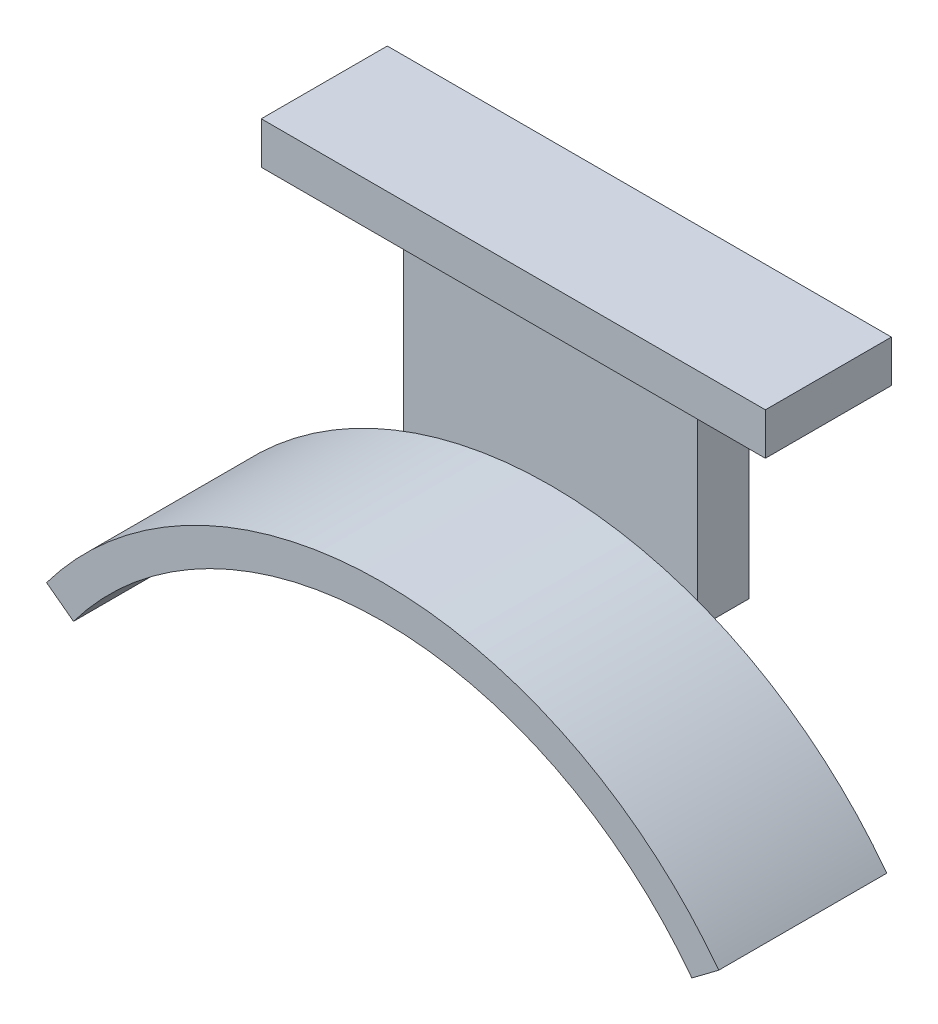
from build123d import *

# Parameters (mm, degrees)
SKETCH1_W           = 76.2
SKETCH1_H           = 19.05
BOSS_EXTRUDE1_DEPTH = 6.35
SKETCH2_W           = 44.45
SKETCH2_H           = 7.782009592
BOSS_EXTRUDE2_DEPTH = 33.02
EXTRUDE_THIN1_DEPTH = 25.4
CHAMFER1_SIZE       = 3.81


with BuildPart() as part:
    # Sketch1 → Boss-Extrude1 (new body)
    with BuildSketch(Plane(origin=(0, 0, 0), x_dir=(1, 0, 0), z_dir=(0, 1, 0))):
        Rectangle(SKETCH1_W, SKETCH1_H)
    extrude(amount=BOSS_EXTRUDE1_DEPTH)

    # Sketch2 → Boss-Extrude2 (add)
    with BuildSketch(Plane.XZ):
        Rectangle(SKETCH2_W, SKETCH2_H)
    extrude(amount=BOSS_EXTRUDE2_DEPTH)

    # Chamfer1
    chamfer1_edges = [part.edges().sort_by_distance(p)[0] for p in [
        (22.225, 0, 0),
        (0, 0, 3.891004796),
        (-22.225, 0, 0),
        (0, 0, -3.891004796),
    ]]
    chamfer(chamfer1_edges, length=CHAMFER1_SIZE)


with BuildPart() as body_2:
    # Sketch3 → Extrude-Thin1 (new body)
    with BuildSketch(Plane.XY.offset(3.891004796)):
        with BuildLine():
            ThreePointArc((-50.785128532, -50.829721193), (0, -25.4), (50.814854074, -50.77027011))
            Line((50.814854074, -50.77027011), (46.752638302, -53.820647631))
            ThreePointArc((46.752638302, -53.820647631), (0.002972554, -30.47999913), (-46.719345696, -53.875342628))
            Line((-46.719345696, -53.875342628), (-50.785128532, -50.829721193))
        make_face()
    extrude(amount=EXTRUDE_THIN1_DEPTH)


solid = Compound([part.part, body_2.part])
